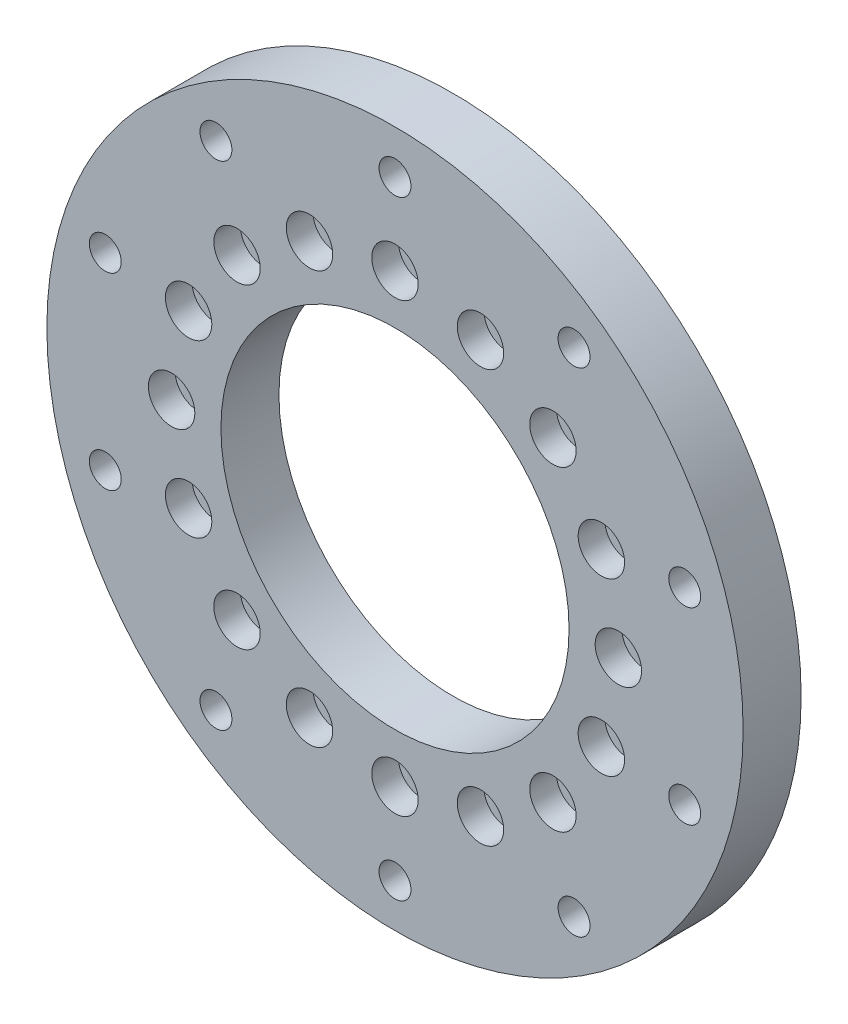
from build123d import *

# Parameters (mm, degrees)
SKETCH_1_R                = 60
EXTRUDE_1_DEPTH           = 10
SKETCH_4_R                = 30
CUT_EXTRUDE_1_DEPTH       = 86.440037453
HOLE_WIZARD_1_D           = 4.5
HOLE_WIZARD_1_CBORE_D     = 8
HOLE_WIZARD_1_CBORE_DEPTH = 4.6
PATTERN_CIRCULAR_1_COUNT  = 16
HOLE_WIZARD_2_D           = 5.5
HOLE_WIZARD_2_CBORE_D     = 10
HOLE_WIZARD_2_CBORE_DEPTH = 5.7
PATTERN_CIRCULAR_2_COUNT  = 10


with BuildPart() as part:
    # 草图1 → 凸台-拉伸1 (new body)
    with BuildSketch(Plane.XY):
        Circle(SKETCH_1_R)
    extrude(amount=EXTRUDE_1_DEPTH)

    # 草图4 → 切除-拉伸1 (cut, through all)
    with BuildSketch(Plane.XY.offset(10)):
        Circle(SKETCH_4_R)
    extrude(amount=-CUT_EXTRUDE_1_DEPTH, mode=Mode.SUBTRACT)

    # 打孔尺寸(%根据)内六角圆柱头螺钉的类型1 (through all)
    with Locations(Plane.XY.offset(10)):
        with Locations((0, 38.5)):
            hole_wizard_1 = CounterBoreHole(HOLE_WIZARD_1_D / 2, HOLE_WIZARD_1_CBORE_D / 2, HOLE_WIZARD_1_CBORE_DEPTH)

    # 阵列(圆周)1: 打孔尺寸(%根据)内六角圆柱头螺钉的类型1 ×16 about axis
    pattern_circular_1_axis = Axis((0, 0, 0), (0, 0, 1))
    for i in range(1, PATTERN_CIRCULAR_1_COUNT):
        add(hole_wizard_1.rotate(pattern_circular_1_axis, i * 360 / PATTERN_CIRCULAR_1_COUNT), mode=Mode.SUBTRACT)

    # 打孔尺寸(%根据)内六角圆柱头螺钉的类型2 (through all)
    with Locations(Plane(origin=(0, 0, 0), x_dir=(-1, 0, 0), z_dir=(0, 0, -1))):
        with Locations((0, 52.5)):
            hole_wizard_2 = CounterBoreHole(HOLE_WIZARD_2_D / 2, HOLE_WIZARD_2_CBORE_D / 2, HOLE_WIZARD_2_CBORE_DEPTH)

    # 阵列(圆周)2: 打孔尺寸(%根据)内六角圆柱头螺钉的类型2 ×10 about axis
    pattern_circular_2_axis = Axis((0, 0, 0), (0, 0, 1))
    for i in range(1, PATTERN_CIRCULAR_2_COUNT):
        add(hole_wizard_2.rotate(pattern_circular_2_axis, i * 360 / PATTERN_CIRCULAR_2_COUNT), mode=Mode.SUBTRACT)


solid = part.part
